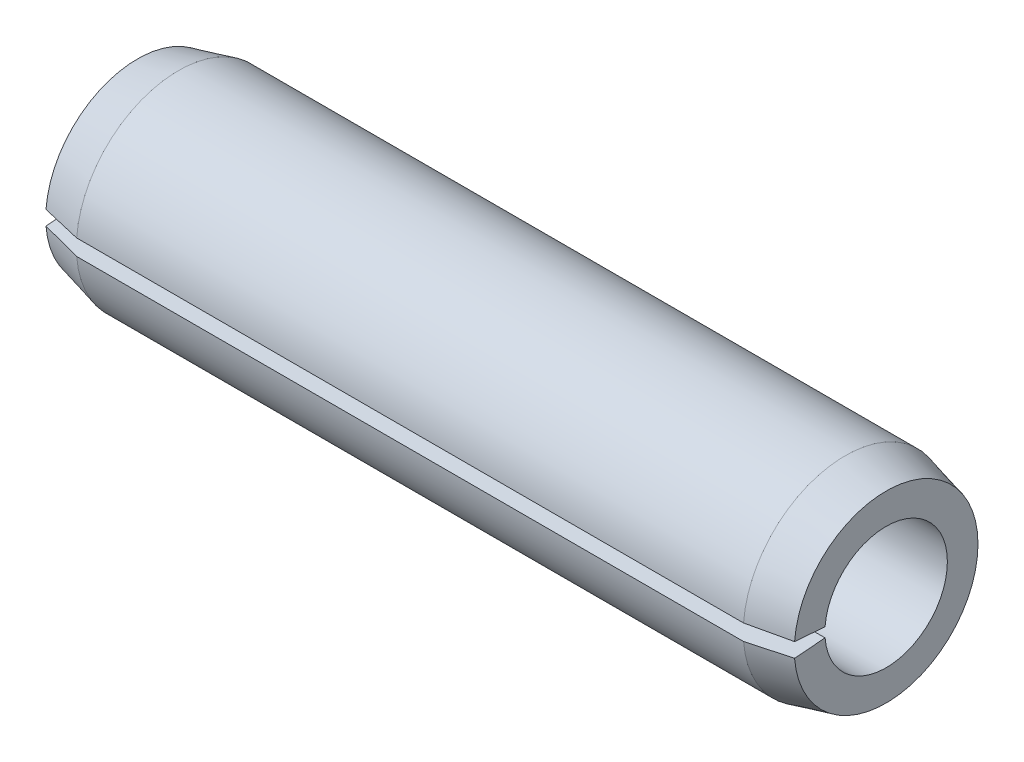
from build123d import *

# Parameters (mm, degrees)
GAP_DEPTH = 23.405356502


with BuildPart() as part:
    # Sketch1 → Base-Revolve (revolve)
    with BuildSketch(Plane.XY, mode=Mode.PRIVATE) as base_revolve_sk:
        Polygon((0, 1.8), (22, 1.8), (22, 2.7), (20.8, 3), (1.2, 3), (0, 2.7), align=None)
    revolve(base_revolve_sk.sketch.rotate(Axis((-9.525, 0, 0), (1, 0, 0)), 90), axis=Axis((-9.525, 0, 0), (1, 0, 0)))

    # Sketch2 → Gap (cut, through all)
    with BuildSketch(Plane(origin=(0, 0, 0), x_dir=(0, -1, 0), z_dir=(-1, 0, 0))):
        with BuildLine():
            Line((0, 0), (0.240084833, 3.050567041))
            ThreePointArc((0.240084833, 3.050567041), (0, 3.06), (-0.240084833, 3.050567041))
            Line((-0.240084833, 3.050567041), (0, 0))
        make_face()
    extrude(amount=-GAP_DEPTH, mode=Mode.SUBTRACT)


solid = part.part
